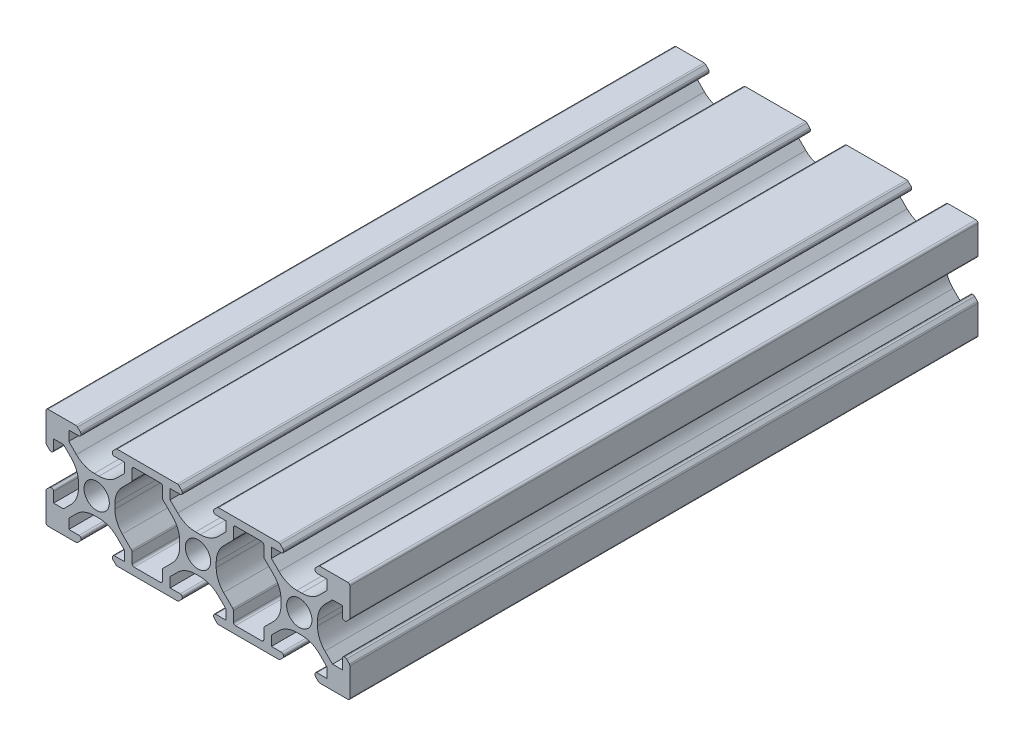
from build123d import *

# Parameters (mm, degrees)
RESSALTO_EXTRUS_O1_DEPTH    = 124
PADR_OCIRCULAR1_COUNT       = 4
PADR_O_LINEAR1_COUNT        = 3
PADR_O_LINEAR1_PITCH        = 20
PADR_O_LINEAR1_COPY_1_DEPTH = 124
PADR_O_LINEAR1_COPY_2_DEPTH = 124
PADR_O_LINEAR1_COPY_3_DEPTH = 124
PADR_O_LINEAR1_COPY_4_DEPTH = 124
PADR_O_LINEAR1_COPY_5_DEPTH = 124
PADR_O_LINEAR1_COPY_6_DEPTH = 124
CORTE_EXTRUS_O1_DEPTH       = 135.074606097
PADR_O_LINEAR2_COUNT        = 2
PADR_O_LINEAR2_PITCH        = 20
FILETE1_R                   = 0.4
FILETE2_R                   = 0.4


with BuildPart() as part:
    # Esboço1 → Ressalto-extrusão1 (new body)
    with BuildSketch(Plane.XY):
        with BuildLine():
            ThreePointArc((-9.317157288, 3.217157288), (-9.187387948, 3.130448187), (-9.034314575, 3.1))
            Line((-9.034314575, 3.1), (-8.9, 3.1))
            ThreePointArc((-8.9, 3.1), (-8.617157288, 3.217157288), (-8.5, 3.5))
            Line((-8.5, 3.5), (-8.5, 5.5))
            Line((-8.5, 5.5), (-6.560660172, 5.5))
            Line((-6.560660172, 5.5), (-5.064466094, 4.003805922))
            ThreePointArc((-5.064466094, 4.003805922), (-3.980602337, 2.381689178), (-3.6, 0.468272016))
            Line((-3.6, 0.468272016), (-3.6, 0))
            Line((-3.6, 0), (-2.5, 0))
            ThreePointArc((-2.5, 0), (-1.767766953, 1.767766953), (0, 2.5))
            Line((0, 2.5), (0, 3.6))
            Line((0, 3.6), (-0.468272016, 3.6))
            ThreePointArc((-0.468272016, 3.6), (-2.381689178, 3.980602337), (-4.003805922, 5.064466094))
            Line((-4.003805922, 5.064466094), (-5.5, 6.560660172))
            Line((-5.5, 6.560660172), (-5.5, 8.5))
            Line((-5.5, 8.5), (-3.5, 8.5))
            ThreePointArc((-3.5, 8.5), (-3.217157288, 8.617157288), (-3.1, 8.9))
            Line((-3.1, 8.9), (-3.1, 9.034314575))
            ThreePointArc((-3.1, 9.034314575), (-3.130448187, 9.187387948), (-3.217157288, 9.317157288))
            Line((-3.217157288, 9.317157288), (-3.782842712, 9.882842712))
            ThreePointArc((-3.782842712, 9.882842712), (-3.912612052, 9.969551813), (-4.065685425, 10))
            Line((-4.065685425, 10), (-10, 10))
            Line((-10, 10), (-10, 4.065685425))
            ThreePointArc((-10, 4.065685425), (-9.969551813, 3.912612052), (-9.882842712, 3.782842712))
            Line((-9.882842712, 3.782842712), (-9.317157288, 3.217157288))
        make_face()
    ressalto_extrus_o1 = extrude(amount=RESSALTO_EXTRUS_O1_DEPTH)

    # PadrãoCircular1: Ressalto-extrusão1 ×4 about axis
    padr_ocircular1_axis = Axis((0, 0, 0), (0, 0, 1))
    for i in range(1, PADR_OCIRCULAR1_COUNT):
        add(ressalto_extrus_o1.rotate(padr_ocircular1_axis, i * 360 / PADR_OCIRCULAR1_COUNT))

    # Padrão linear1: Ressalto-extrusão1 ×3
    with Locations(*[(i * PADR_O_LINEAR1_PITCH, 0, 0) for i in range(1, PADR_O_LINEAR1_COUNT)]):
        add(ressalto_extrus_o1)

    # Padrão linear1 copy 1 sketch → Padrão linear1 copy 1 (add)
    with BuildSketch(Plane(origin=(20, 0, 0), x_dir=(0, 1, 0), z_dir=(0, 0, 1))):
        with BuildLine():
            ThreePointArc((-9.317157288, 3.217157288), (-9.187387948, 3.130448187), (-9.034314575, 3.1))
            Line((-9.034314575, 3.1), (-8.9, 3.1))
            ThreePointArc((-8.9, 3.1), (-8.617157288, 3.217157288), (-8.5, 3.5))
            Line((-8.5, 3.5), (-8.5, 5.5))
            Line((-8.5, 5.5), (-6.560660172, 5.5))
            Line((-6.560660172, 5.5), (-5.064466094, 4.003805922))
            ThreePointArc((-5.064466094, 4.003805922), (-3.980602337, 2.381689178), (-3.6, 0.468272016))
            Line((-3.6, 0.468272016), (-3.6, 0))
            Line((-3.6, 0), (-2.5, 0))
            ThreePointArc((-2.5, 0), (-1.767766953, 1.767766953), (0, 2.5))
            Line((0, 2.5), (0, 3.6))
            Line((0, 3.6), (-0.468272016, 3.6))
            ThreePointArc((-0.468272016, 3.6), (-2.381689178, 3.980602337), (-4.003805922, 5.064466094))
            Line((-4.003805922, 5.064466094), (-5.5, 6.560660172))
            Line((-5.5, 6.560660172), (-5.5, 8.5))
            Line((-5.5, 8.5), (-3.5, 8.5))
            ThreePointArc((-3.5, 8.5), (-3.217157288, 8.617157288), (-3.1, 8.9))
            Line((-3.1, 8.9), (-3.1, 9.034314575))
            ThreePointArc((-3.1, 9.034314575), (-3.130448187, 9.187387948), (-3.217157288, 9.317157288))
            Line((-3.217157288, 9.317157288), (-3.782842712, 9.882842712))
            ThreePointArc((-3.782842712, 9.882842712), (-3.912612052, 9.969551813), (-4.065685425, 10))
            Line((-4.065685425, 10), (-10, 10))
            Line((-10, 10), (-10, 4.065685425))
            ThreePointArc((-10, 4.065685425), (-9.969551813, 3.912612052), (-9.882842712, 3.782842712))
            Line((-9.882842712, 3.782842712), (-9.317157288, 3.217157288))
        make_face()
    extrude(amount=PADR_O_LINEAR1_COPY_1_DEPTH)

    # Padrão linear1 copy 2 sketch → Padrão linear1 copy 2 (add)
    with BuildSketch(Plane(origin=(40, 0, 0), x_dir=(0, 1, 0), z_dir=(0, 0, 1))):
        with BuildLine():
            ThreePointArc((-9.317157288, 3.217157288), (-9.187387948, 3.130448187), (-9.034314575, 3.1))
            Line((-9.034314575, 3.1), (-8.9, 3.1))
            ThreePointArc((-8.9, 3.1), (-8.617157288, 3.217157288), (-8.5, 3.5))
            Line((-8.5, 3.5), (-8.5, 5.5))
            Line((-8.5, 5.5), (-6.560660172, 5.5))
            Line((-6.560660172, 5.5), (-5.064466094, 4.003805922))
            ThreePointArc((-5.064466094, 4.003805922), (-3.980602337, 2.381689178), (-3.6, 0.468272016))
            Line((-3.6, 0.468272016), (-3.6, 0))
            Line((-3.6, 0), (-2.5, 0))
            ThreePointArc((-2.5, 0), (-1.767766953, 1.767766953), (0, 2.5))
            Line((0, 2.5), (0, 3.6))
            Line((0, 3.6), (-0.468272016, 3.6))
            ThreePointArc((-0.468272016, 3.6), (-2.381689178, 3.980602337), (-4.003805922, 5.064466094))
            Line((-4.003805922, 5.064466094), (-5.5, 6.560660172))
            Line((-5.5, 6.560660172), (-5.5, 8.5))
            Line((-5.5, 8.5), (-3.5, 8.5))
            ThreePointArc((-3.5, 8.5), (-3.217157288, 8.617157288), (-3.1, 8.9))
            Line((-3.1, 8.9), (-3.1, 9.034314575))
            ThreePointArc((-3.1, 9.034314575), (-3.130448187, 9.187387948), (-3.217157288, 9.317157288))
            Line((-3.217157288, 9.317157288), (-3.782842712, 9.882842712))
            ThreePointArc((-3.782842712, 9.882842712), (-3.912612052, 9.969551813), (-4.065685425, 10))
            Line((-4.065685425, 10), (-10, 10))
            Line((-10, 10), (-10, 4.065685425))
            ThreePointArc((-10, 4.065685425), (-9.969551813, 3.912612052), (-9.882842712, 3.782842712))
            Line((-9.882842712, 3.782842712), (-9.317157288, 3.217157288))
        make_face()
    extrude(amount=PADR_O_LINEAR1_COPY_2_DEPTH)

    # Padrão linear1 copy 3 sketch → Padrão linear1 copy 3 (add)
    with BuildSketch(Plane(origin=(20, 0, 0), x_dir=(-1, 0, 0), z_dir=(0, 0, 1))):
        with BuildLine():
            ThreePointArc((-9.317157288, 3.217157288), (-9.187387948, 3.130448187), (-9.034314575, 3.1))
            Line((-9.034314575, 3.1), (-8.9, 3.1))
            ThreePointArc((-8.9, 3.1), (-8.617157288, 3.217157288), (-8.5, 3.5))
            Line((-8.5, 3.5), (-8.5, 5.5))
            Line((-8.5, 5.5), (-6.560660172, 5.5))
            Line((-6.560660172, 5.5), (-5.064466094, 4.003805922))
            ThreePointArc((-5.064466094, 4.003805922), (-3.980602337, 2.381689178), (-3.6, 0.468272016))
            Line((-3.6, 0.468272016), (-3.6, 0))
            Line((-3.6, 0), (-2.5, 0))
            ThreePointArc((-2.5, 0), (-1.767766953, 1.767766953), (0, 2.5))
            Line((0, 2.5), (0, 3.6))
            Line((0, 3.6), (-0.468272016, 3.6))
            ThreePointArc((-0.468272016, 3.6), (-2.381689178, 3.980602337), (-4.003805922, 5.064466094))
            Line((-4.003805922, 5.064466094), (-5.5, 6.560660172))
            Line((-5.5, 6.560660172), (-5.5, 8.5))
            Line((-5.5, 8.5), (-3.5, 8.5))
            ThreePointArc((-3.5, 8.5), (-3.217157288, 8.617157288), (-3.1, 8.9))
            Line((-3.1, 8.9), (-3.1, 9.034314575))
            ThreePointArc((-3.1, 9.034314575), (-3.130448187, 9.187387948), (-3.217157288, 9.317157288))
            Line((-3.217157288, 9.317157288), (-3.782842712, 9.882842712))
            ThreePointArc((-3.782842712, 9.882842712), (-3.912612052, 9.969551813), (-4.065685425, 10))
            Line((-4.065685425, 10), (-10, 10))
            Line((-10, 10), (-10, 4.065685425))
            ThreePointArc((-10, 4.065685425), (-9.969551813, 3.912612052), (-9.882842712, 3.782842712))
            Line((-9.882842712, 3.782842712), (-9.317157288, 3.217157288))
        make_face()
    extrude(amount=PADR_O_LINEAR1_COPY_3_DEPTH)

    # Padrão linear1 copy 4 sketch → Padrão linear1 copy 4 (add)
    with BuildSketch(Plane(origin=(40, 0, 0), x_dir=(-1, 0, 0), z_dir=(0, 0, 1))):
        with BuildLine():
            ThreePointArc((-9.317157288, 3.217157288), (-9.187387948, 3.130448187), (-9.034314575, 3.1))
            Line((-9.034314575, 3.1), (-8.9, 3.1))
            ThreePointArc((-8.9, 3.1), (-8.617157288, 3.217157288), (-8.5, 3.5))
            Line((-8.5, 3.5), (-8.5, 5.5))
            Line((-8.5, 5.5), (-6.560660172, 5.5))
            Line((-6.560660172, 5.5), (-5.064466094, 4.003805922))
            ThreePointArc((-5.064466094, 4.003805922), (-3.980602337, 2.381689178), (-3.6, 0.468272016))
            Line((-3.6, 0.468272016), (-3.6, 0))
            Line((-3.6, 0), (-2.5, 0))
            ThreePointArc((-2.5, 0), (-1.767766953, 1.767766953), (0, 2.5))
            Line((0, 2.5), (0, 3.6))
            Line((0, 3.6), (-0.468272016, 3.6))
            ThreePointArc((-0.468272016, 3.6), (-2.381689178, 3.980602337), (-4.003805922, 5.064466094))
            Line((-4.003805922, 5.064466094), (-5.5, 6.560660172))
            Line((-5.5, 6.560660172), (-5.5, 8.5))
            Line((-5.5, 8.5), (-3.5, 8.5))
            ThreePointArc((-3.5, 8.5), (-3.217157288, 8.617157288), (-3.1, 8.9))
            Line((-3.1, 8.9), (-3.1, 9.034314575))
            ThreePointArc((-3.1, 9.034314575), (-3.130448187, 9.187387948), (-3.217157288, 9.317157288))
            Line((-3.217157288, 9.317157288), (-3.782842712, 9.882842712))
            ThreePointArc((-3.782842712, 9.882842712), (-3.912612052, 9.969551813), (-4.065685425, 10))
            Line((-4.065685425, 10), (-10, 10))
            Line((-10, 10), (-10, 4.065685425))
            ThreePointArc((-10, 4.065685425), (-9.969551813, 3.912612052), (-9.882842712, 3.782842712))
            Line((-9.882842712, 3.782842712), (-9.317157288, 3.217157288))
        make_face()
    extrude(amount=PADR_O_LINEAR1_COPY_4_DEPTH)

    # Padrão linear1 copy 5 sketch → Padrão linear1 copy 5 (add)
    with BuildSketch(Plane(origin=(20, 0, 0), x_dir=(0, -1, 0), z_dir=(0, 0, 1))):
        with BuildLine():
            ThreePointArc((-9.317157288, 3.217157288), (-9.187387948, 3.130448187), (-9.034314575, 3.1))
            Line((-9.034314575, 3.1), (-8.9, 3.1))
            ThreePointArc((-8.9, 3.1), (-8.617157288, 3.217157288), (-8.5, 3.5))
            Line((-8.5, 3.5), (-8.5, 5.5))
            Line((-8.5, 5.5), (-6.560660172, 5.5))
            Line((-6.560660172, 5.5), (-5.064466094, 4.003805922))
            ThreePointArc((-5.064466094, 4.003805922), (-3.980602337, 2.381689178), (-3.6, 0.468272016))
            Line((-3.6, 0.468272016), (-3.6, 0))
            Line((-3.6, 0), (-2.5, 0))
            ThreePointArc((-2.5, 0), (-1.767766953, 1.767766953), (0, 2.5))
            Line((0, 2.5), (0, 3.6))
            Line((0, 3.6), (-0.468272016, 3.6))
            ThreePointArc((-0.468272016, 3.6), (-2.381689178, 3.980602337), (-4.003805922, 5.064466094))
            Line((-4.003805922, 5.064466094), (-5.5, 6.560660172))
            Line((-5.5, 6.560660172), (-5.5, 8.5))
            Line((-5.5, 8.5), (-3.5, 8.5))
            ThreePointArc((-3.5, 8.5), (-3.217157288, 8.617157288), (-3.1, 8.9))
            Line((-3.1, 8.9), (-3.1, 9.034314575))
            ThreePointArc((-3.1, 9.034314575), (-3.130448187, 9.187387948), (-3.217157288, 9.317157288))
            Line((-3.217157288, 9.317157288), (-3.782842712, 9.882842712))
            ThreePointArc((-3.782842712, 9.882842712), (-3.912612052, 9.969551813), (-4.065685425, 10))
            Line((-4.065685425, 10), (-10, 10))
            Line((-10, 10), (-10, 4.065685425))
            ThreePointArc((-10, 4.065685425), (-9.969551813, 3.912612052), (-9.882842712, 3.782842712))
            Line((-9.882842712, 3.782842712), (-9.317157288, 3.217157288))
        make_face()
    extrude(amount=PADR_O_LINEAR1_COPY_5_DEPTH)

    # Padrão linear1 copy 6 sketch → Padrão linear1 copy 6 (add)
    with BuildSketch(Plane(origin=(40, 0, 0), x_dir=(0, -1, 0), z_dir=(0, 0, 1))):
        with BuildLine():
            ThreePointArc((-9.317157288, 3.217157288), (-9.187387948, 3.130448187), (-9.034314575, 3.1))
            Line((-9.034314575, 3.1), (-8.9, 3.1))
            ThreePointArc((-8.9, 3.1), (-8.617157288, 3.217157288), (-8.5, 3.5))
            Line((-8.5, 3.5), (-8.5, 5.5))
            Line((-8.5, 5.5), (-6.560660172, 5.5))
            Line((-6.560660172, 5.5), (-5.064466094, 4.003805922))
            ThreePointArc((-5.064466094, 4.003805922), (-3.980602337, 2.381689178), (-3.6, 0.468272016))
            Line((-3.6, 0.468272016), (-3.6, 0))
            Line((-3.6, 0), (-2.5, 0))
            ThreePointArc((-2.5, 0), (-1.767766953, 1.767766953), (0, 2.5))
            Line((0, 2.5), (0, 3.6))
            Line((0, 3.6), (-0.468272016, 3.6))
            ThreePointArc((-0.468272016, 3.6), (-2.381689178, 3.980602337), (-4.003805922, 5.064466094))
            Line((-4.003805922, 5.064466094), (-5.5, 6.560660172))
            Line((-5.5, 6.560660172), (-5.5, 8.5))
            Line((-5.5, 8.5), (-3.5, 8.5))
            ThreePointArc((-3.5, 8.5), (-3.217157288, 8.617157288), (-3.1, 8.9))
            Line((-3.1, 8.9), (-3.1, 9.034314575))
            ThreePointArc((-3.1, 9.034314575), (-3.130448187, 9.187387948), (-3.217157288, 9.317157288))
            Line((-3.217157288, 9.317157288), (-3.782842712, 9.882842712))
            ThreePointArc((-3.782842712, 9.882842712), (-3.912612052, 9.969551813), (-4.065685425, 10))
            Line((-4.065685425, 10), (-10, 10))
            Line((-10, 10), (-10, 4.065685425))
            ThreePointArc((-10, 4.065685425), (-9.969551813, 3.912612052), (-9.882842712, 3.782842712))
            Line((-9.882842712, 3.782842712), (-9.317157288, 3.217157288))
        make_face()
    extrude(amount=PADR_O_LINEAR1_COPY_6_DEPTH)

    # Esboço4 → Corte-extrusão1 (cut, through all)
    with BuildSketch(Plane(origin=(0, 0, 0), x_dir=(-1, 0, 0), z_dir=(0, 0, -1))):
        Polygon((-13.439339828, 5.5), (-13, 5.939339828), (-13, 8.5), (-7, 8.5), (-7, 5.939339828), (-6.560660172, 5.5), (-6.560660172, -5.5), (-7, -5.939339828), (-7, -8.5), (-13, -8.5), (-13, -5.939339828), (-13.439339828, -5.5), align=None)
    corte_extrus_o1 = extrude(amount=-CORTE_EXTRUS_O1_DEPTH, mode=Mode.SUBTRACT)

    # Padrão linear2: Corte-extrusão1 ×2
    with Locations(*[(i * PADR_O_LINEAR2_PITCH, 0, 0) for i in range(1, PADR_O_LINEAR2_COUNT)]):
        add(corte_extrus_o1, mode=Mode.SUBTRACT)

    # Filete1
    filete1_edges = [part.edges().sort_by_distance(p)[0] for p in [
        (13, 5.939339828, 62),
        (13, 8.5, 62),
        (7, 8.5, 62),
        (7, 5.939339828, 62),
        (7, -5.939339828, 62),
        (7, -8.5, 62),
        (13, -8.5, 62),
        (13, -5.939339828, 62),
        (33, 5.939339828, 62),
        (33, 8.5, 62),
        (27, 8.5, 62),
        (27, 5.939339828, 62),
        (27, -5.939339828, 62),
        (27, -8.5, 62),
        (33, -8.5, 62),
        (33, -5.939339828, 62),
    ]]
    fillet(filete1_edges, radius=FILETE1_R)

    # Filete2
    filete2_edges = [part.edges().sort_by_distance(p)[0] for p in [
        (-10, 10, 62),
        (50, -10, 62),
        (50, 10, 62),
        (-10, -10, 62),
    ]]
    fillet(filete2_edges, radius=FILETE2_R)


solid = part.part
